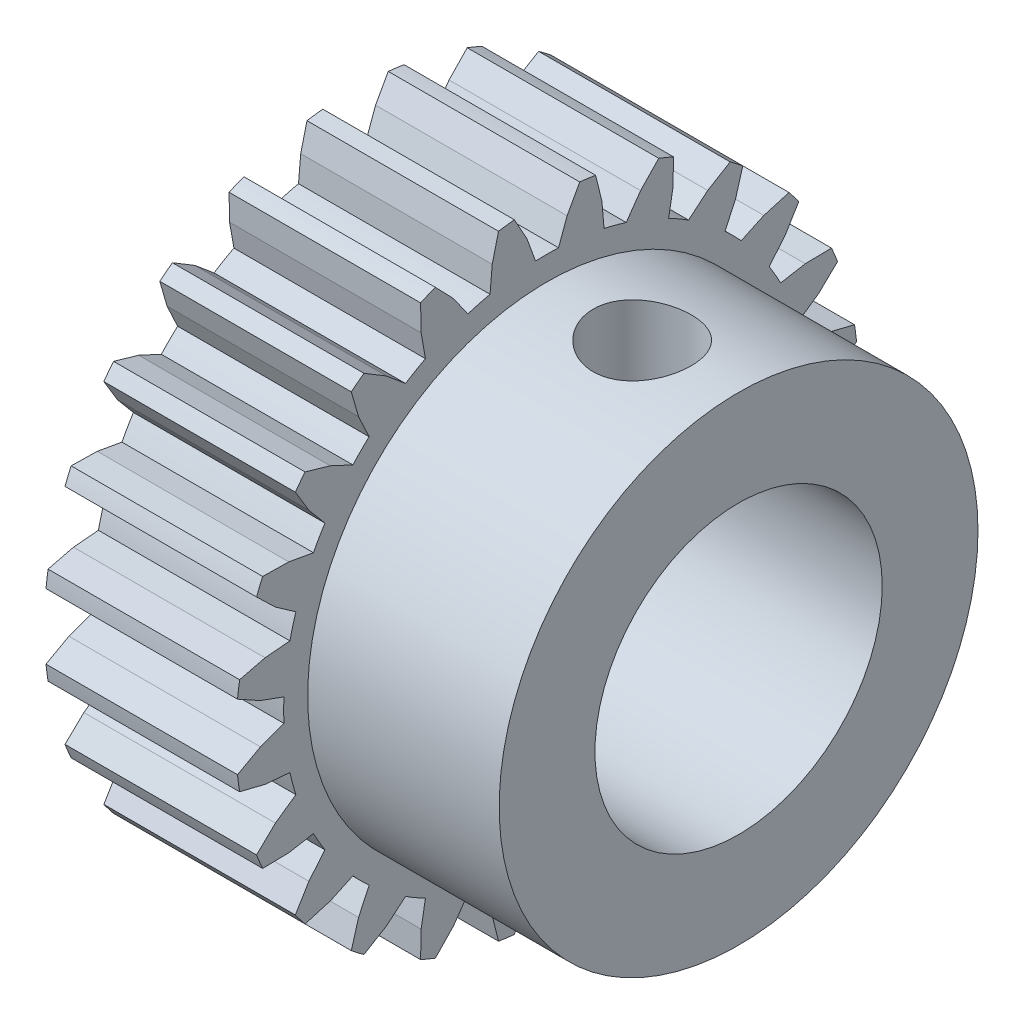
from build123d import *

# Parameters (mm, degrees)
BOSS_EXTRUDE1_DEPTH      = 4
SKETCH2_W                = 4
SKETCH2_H                = 5
F_6_0_6_DIAMETER_HOLE1_D = 6
SKETCH5_W                = 1.025
SKETCH5_H                = 2.1273923


with BuildPart() as part:
    # Sketch1 → Boss-Extrude1 (new body)
    with BuildSketch(Plane(origin=(2, 0, 0), x_dir=(0, 0, -1), z_dir=(1, 0, 0))):
        with BuildLine():
            Line((-5.494765219, -0.239906631), (-5.985388493, -0.418478899))
            Line((-5.985388493, -0.418478899), (-6.464027144, -0.682900491))
            ThreePointArc((-6.464027144, -0.682900491), (-6.444391599, -0.84842025), (-6.420518413, -1.013382112))
            Line((-6.420518413, -1.013382112), (-5.889751635, -1.144912958))
            Line((-5.889751635, -1.144912958), (-5.369628039, -1.190417877))
            ThreePointArc((-5.369628039, -1.190417877), (-5.312592045, -1.423504748), (-5.245443229, -1.653881897))
            Line((-5.245443229, -1.653881897), (-5.673131017, -1.95335211))
            Line((-5.673131017, -1.95335211), (-6.067023107, -2.332644554))
            ThreePointArc((-6.067023107, -2.332644554), (-6.005216961, -2.487442311), (-5.939461963, -2.640604399))
            Line((-5.939461963, -2.640604399), (-5.392737936, -2.630280889))
            Line((-5.392737936, -2.630280889), (-4.878559582, -2.539617373))
            ThreePointArc((-4.878559582, -2.539617373), (-4.763139721, -2.750000001), (-4.638652952, -2.955147847))
            Line((-4.638652952, -2.955147847), (-4.974259037, -3.355107604))
            Line((-4.974259037, -3.355107604), (-5.256561472, -3.823422746))
            ThreePointArc((-5.256561472, -3.823422746), (-5.156796712, -3.956949288), (-5.053640997, -4.087873858))
            Line((-5.053640997, -4.087873858), (-4.528218058, -3.936399524))
            Line((-4.528218058, -3.936399524), (-4.055025352, -3.715746142))
            ThreePointArc((-4.055025352, -3.715746142), (-3.889087296, -3.889087297), (-3.715746141, -4.055025353))
            Line((-3.715746141, -4.055025353), (-3.936399524, -4.528218058))
            Line((-3.936399524, -4.528218058), (-4.087873859, -5.053640996))
            ThreePointArc((-4.087873859, -5.053640996), (-3.956949289, -5.156796712), (-3.823422746, -5.256561471))
            Line((-3.823422746, -5.256561471), (-3.355107604, -4.974259037))
            Line((-3.355107604, -4.974259037), (-2.955147846, -4.638652952))
            ThreePointArc((-2.955147846, -4.638652952), (-2.75, -4.763139721), (-2.539617374, -4.878559582))
            Line((-2.539617374, -4.878559582), (-2.630280889, -5.392737936))
            Line((-2.630280889, -5.392737936), (-2.640604398, -5.939461963))
            ThreePointArc((-2.640604398, -5.939461963), (-2.48744231, -6.005216961), (-2.332644554, -6.067023107))
            Line((-2.332644554, -6.067023107), (-1.95335211, -5.673131017))
            Line((-1.95335211, -5.673131017), (-1.653881897, -5.245443229))
            ThreePointArc((-1.653881897, -5.245443229), (-1.423504748, -5.312592045), (-1.190417877, -5.369628039))
            Line((-1.190417877, -5.369628039), (-1.144912958, -5.889751635))
            Line((-1.144912958, -5.889751635), (-1.013382112, -6.420518413))
            ThreePointArc((-1.013382112, -6.420518413), (-0.848420249, -6.444391599), (-0.682900491, -6.464027144))
            Line((-0.682900491, -6.464027144), (-0.418478899, -5.985388493))
            Line((-0.418478899, -5.985388493), (-0.239906631, -5.494765219))
            ThreePointArc((-0.239906631, -5.494765219), (0, -5.5), (0.239906631, -5.494765219))
            Line((0.239906631, -5.494765219), (0.418478899, -5.985388493))
            Line((0.418478899, -5.985388493), (0.682900491, -6.464027144))
            ThreePointArc((0.682900491, -6.464027144), (0.84842025, -6.444391599), (1.013382113, -6.420518413))
            Line((1.013382113, -6.420518413), (1.144912958, -5.889751635))
            Line((1.144912958, -5.889751635), (1.190417877, -5.369628039))
            ThreePointArc((1.190417877, -5.369628039), (1.423504749, -5.312592045), (1.653881898, -5.245443229))
            Line((1.653881898, -5.245443229), (1.95335211, -5.673131017))
            Line((1.95335211, -5.673131017), (2.332644554, -6.067023107))
            ThreePointArc((2.332644554, -6.067023107), (2.48744231, -6.005216962), (2.640604397, -5.939461964))
            Line((2.640604397, -5.939461964), (2.630280889, -5.392737936))
            Line((2.630280889, -5.392737936), (2.539617373, -4.878559582))
            ThreePointArc((2.539617373, -4.878559582), (2.750000001, -4.76313972), (2.955147847, -4.638652951))
            Line((2.955147847, -4.638652951), (3.355107604, -4.974259037))
            Line((3.355107604, -4.974259037), (3.823422746, -5.256561472))
            ThreePointArc((3.823422746, -5.256561472), (3.956949288, -5.156796712), (4.087873858, -5.053640996))
            Line((4.087873858, -5.053640996), (3.936399524, -4.528218058))
            Line((3.936399524, -4.528218058), (3.715746142, -4.055025352))
            ThreePointArc((3.715746142, -4.055025352), (3.889087296, -3.889087297), (4.055025352, -3.715746143))
            Line((4.055025352, -3.715746143), (4.528218058, -3.936399524))
            Line((4.528218058, -3.936399524), (5.053640996, -4.087873859))
            ThreePointArc((5.053640996, -4.087873859), (5.156796712, -3.956949289), (5.256561472, -3.823422746))
            Line((5.256561472, -3.823422746), (4.974259037, -3.355107604))
            Line((4.974259037, -3.355107604), (4.638652952, -2.955147846))
            ThreePointArc((4.638652952, -2.955147846), (4.763139721, -2.75), (4.878559582, -2.539617373))
            Line((4.878559582, -2.539617373), (5.392737936, -2.630280889))
            Line((5.392737936, -2.630280889), (5.939461963, -2.640604398))
            ThreePointArc((5.939461963, -2.640604398), (6.005216962, -2.48744231), (6.067023108, -2.332644554))
            Line((6.067023108, -2.332644554), (5.673131017, -1.95335211))
            Line((5.673131017, -1.95335211), (5.245443229, -1.653881897))
            ThreePointArc((5.245443229, -1.653881897), (5.312592045, -1.423504748), (5.369628039, -1.190417877))
            Line((5.369628039, -1.190417877), (5.889751635, -1.144912958))
            Line((5.889751635, -1.144912958), (6.420518413, -1.013382112))
            ThreePointArc((6.420518413, -1.013382112), (6.444391599, -0.848420249), (6.464027144, -0.68290049))
            Line((6.464027144, -0.68290049), (5.985388493, -0.418478899))
            Line((5.985388493, -0.418478899), (5.494765219, -0.239906631))
            ThreePointArc((5.494765219, -0.239906631), (5.5, 0), (5.494765219, 0.239906631))
            Line((5.494765219, 0.239906631), (5.985388493, 0.418478899))
            Line((5.985388493, 0.418478899), (6.464027144, 0.682900491))
            ThreePointArc((6.464027144, 0.682900491), (6.444391599, 0.848420249), (6.420518413, 1.013382112))
            Line((6.420518413, 1.013382112), (5.889751635, 1.144912958))
            Line((5.889751635, 1.144912958), (5.369628039, 1.190417877))
            ThreePointArc((5.369628039, 1.190417877), (5.312592045, 1.423504748), (5.245443229, 1.653881897))
            Line((5.245443229, 1.653881897), (5.673131017, 1.95335211))
            Line((5.673131017, 1.95335211), (6.067023107, 2.332644554))
            ThreePointArc((6.067023107, 2.332644554), (6.005216961, 2.48744231), (5.939461963, 2.640604398))
            Line((5.939461963, 2.640604398), (5.392737936, 2.630280889))
            Line((5.392737936, 2.630280889), (4.878559582, 2.539617374))
            ThreePointArc((4.878559582, 2.539617374), (4.763139721, 2.75), (4.638652952, 2.955147846))
            Line((4.638652952, 2.955147846), (4.974259037, 3.355107604))
            Line((4.974259037, 3.355107604), (5.256561472, 3.823422746))
            ThreePointArc((5.256561472, 3.823422746), (5.156796712, 3.956949289), (5.053640996, 4.087873859))
            Line((5.053640996, 4.087873859), (4.528218058, 3.936399524))
            Line((4.528218058, 3.936399524), (4.055025352, 3.715746143))
            ThreePointArc((4.055025352, 3.715746143), (3.889087296, 3.889087297), (3.715746142, 4.055025352))
            Line((3.715746142, 4.055025352), (3.936399524, 4.528218058))
            Line((3.936399524, 4.528218058), (4.087873858, 5.053640997))
            ThreePointArc((4.087873858, 5.053640997), (3.956949288, 5.156796712), (3.823422746, 5.256561472))
            Line((3.823422746, 5.256561472), (3.355107604, 4.974259037))
            Line((3.355107604, 4.974259037), (2.955147847, 4.638652952))
            ThreePointArc((2.955147847, 4.638652952), (2.750000001, 4.763139721), (2.539617373, 4.878559582))
            Line((2.539617373, 4.878559582), (2.630280889, 5.392737936))
            Line((2.630280889, 5.392737936), (2.640604399, 5.939461963))
            ThreePointArc((2.640604399, 5.939461963), (2.487442311, 6.005216961), (2.332644554, 6.067023107))
            Line((2.332644554, 6.067023107), (1.95335211, 5.673131017))
            Line((1.95335211, 5.673131017), (1.653881898, 5.245443229))
            ThreePointArc((1.653881898, 5.245443229), (1.423504748, 5.312592045), (1.190417877, 5.369628039))
            Line((1.190417877, 5.369628039), (1.144912958, 5.889751635))
            Line((1.144912958, 5.889751635), (1.013382112, 6.420518413))
            ThreePointArc((1.013382112, 6.420518413), (0.84842025, 6.444391599), (0.682900491, 6.464027144))
            Line((0.682900491, 6.464027144), (0.418478899, 5.985388493))
            Line((0.418478899, 5.985388493), (0.239906631, 5.494765219))
            ThreePointArc((0.239906631, 5.494765219), (0, 5.5), (-0.239906631, 5.494765219))
            Line((-0.239906631, 5.494765219), (-0.418478899, 5.985388493))
            Line((-0.418478899, 5.985388493), (-0.682900491, 6.464027144))
            ThreePointArc((-0.682900491, 6.464027144), (-0.84842025, 6.444391599), (-1.013382112, 6.420518413))
            Line((-1.013382112, 6.420518413), (-1.144912958, 5.889751635))
            Line((-1.144912958, 5.889751635), (-1.190417878, 5.369628039))
            ThreePointArc((-1.190417878, 5.369628039), (-1.423504748, 5.312592045), (-1.653881897, 5.245443229))
            Line((-1.653881897, 5.245443229), (-1.95335211, 5.673131017))
            Line((-1.95335211, 5.673131017), (-2.332644555, 6.067023107))
            ThreePointArc((-2.332644555, 6.067023107), (-2.487442311, 6.005216961), (-2.640604398, 5.939461963))
            Line((-2.640604398, 5.939461963), (-2.630280889, 5.392737936))
            Line((-2.630280889, 5.392737936), (-2.539617374, 4.878559582))
            ThreePointArc((-2.539617374, 4.878559582), (-2.750000001, 4.76313972), (-2.955147846, 4.638652952))
            Line((-2.955147846, 4.638652952), (-3.355107604, 4.974259037))
            Line((-3.355107604, 4.974259037), (-3.823422747, 5.256561471))
            ThreePointArc((-3.823422747, 5.256561471), (-3.956949289, 5.156796712), (-4.087873859, 5.053640996))
            Line((-4.087873859, 5.053640996), (-3.936399524, 4.528218058))
            Line((-3.936399524, 4.528218058), (-3.715746141, 4.055025353))
            ThreePointArc((-3.715746141, 4.055025353), (-3.889087296, 3.889087297), (-4.055025352, 3.715746142))
            Line((-4.055025352, 3.715746142), (-4.528218058, 3.936399524))
            Line((-4.528218058, 3.936399524), (-5.053640995, 4.08787386))
            ThreePointArc((-5.053640995, 4.08787386), (-5.156796711, 3.956949289), (-5.256561472, 3.823422746))
            Line((-5.256561472, 3.823422746), (-4.974259037, 3.355107604))
            Line((-4.974259037, 3.355107604), (-4.638652952, 2.955147846))
            ThreePointArc((-4.638652952, 2.955147846), (-4.763139721, 2.75), (-4.878559582, 2.539617373))
            Line((-4.878559582, 2.539617373), (-5.392737936, 2.630280889))
            Line((-5.392737936, 2.630280889), (-5.939461963, 2.640604399))
            ThreePointArc((-5.939461963, 2.640604399), (-6.005216961, 2.487442311), (-6.067023107, 2.332644554))
            Line((-6.067023107, 2.332644554), (-5.673131017, 1.95335211))
            Line((-5.673131017, 1.95335211), (-5.245443229, 1.653881897))
            ThreePointArc((-5.245443229, 1.653881897), (-5.312592045, 1.423504748), (-5.369628039, 1.190417877))
            Line((-5.369628039, 1.190417877), (-5.889751635, 1.144912958))
            Line((-5.889751635, 1.144912958), (-6.420518413, 1.013382112))
            ThreePointArc((-6.420518413, 1.013382112), (-6.444391599, 0.848420249), (-6.464027144, 0.682900491))
            Line((-6.464027144, 0.682900491), (-5.985388493, 0.418478899))
            Line((-5.985388493, 0.418478899), (-5.494765219, 0.23990663))
            ThreePointArc((-5.494765219, 0.23990663), (-5.5, -1e-09), (-5.494765219, -0.239906631))
        make_face()
    extrude(amount=-BOSS_EXTRUDE1_DEPTH)

    # Sketch2 → Revolve1 (revolve)
    with BuildSketch(Plane.XY, mode=Mode.PRIVATE) as revolve1_sk:
        with Locations((4, 2.5)):
            Rectangle(SKETCH2_W, SKETCH2_H)
    revolve(revolve1_sk.sketch.rotate(Axis((2, 0, 0), (1, 0, 0)), 270), axis=Axis((2, 0, 0), (1, 0, 0)))

    # Ø6.0 (6) Diameter Hole1 (through all)
    with Locations(Plane(origin=(6, 0, 0), x_dir=(0, 0, -1), z_dir=(1, 0, 0))):
        with Locations((0, 0)):
            Hole(F_6_0_6_DIAMETER_HOLE1_D / 2)

    # Sketch5 → M2.5x0.45 Tapped Hole1 (revolve, cut)
    with BuildSketch(Plane(origin=(4, 2.87259786, 0.007519122), x_dir=(0, 0.0026175250609996566, -0.9999965742754098), z_dir=(1, 0, 0))):
        with Locations((0.5125, 1.06369615)):
            Rectangle(SKETCH5_W, SKETCH5_H)
    revolve(axis=Axis((4, -3.477380387, -0.009102162), (0, 0.9999965742754098, 0.0026175250609996566)), mode=Mode.SUBTRACT)


solid = part.part
